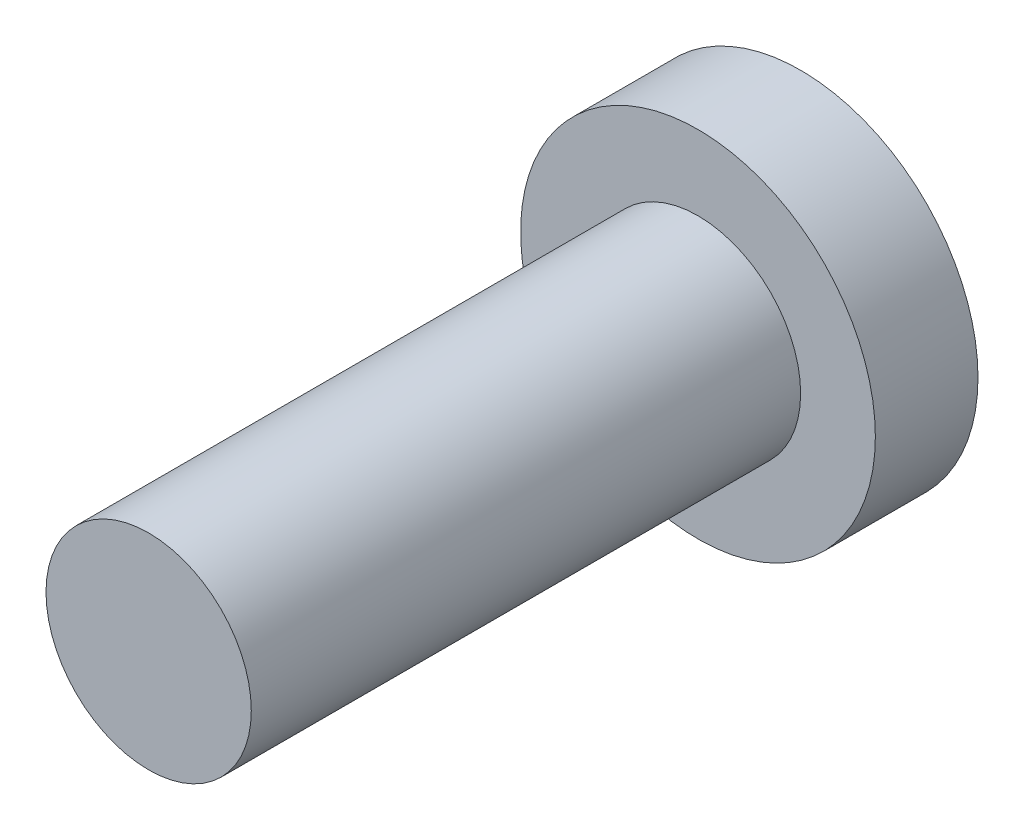
from build123d import *

# Parameters (mm, degrees)
SKETCH1_R   = 4.32
HEAD_DEPTH  = 2.5
SKETCH2_R   = 2.5
SHANK_DEPTH = 13.38


with BuildPart() as part:
    # Sketch1 → Head (new body)
    with BuildSketch(Plane.XY):
        Circle(SKETCH1_R)
    extrude(amount=HEAD_DEPTH)

    # Sketch2 → Shank (add)
    with BuildSketch(Plane.XY.offset(2.5)):
        Circle(SKETCH2_R)
    extrude(amount=SHANK_DEPTH)


solid = part.part
